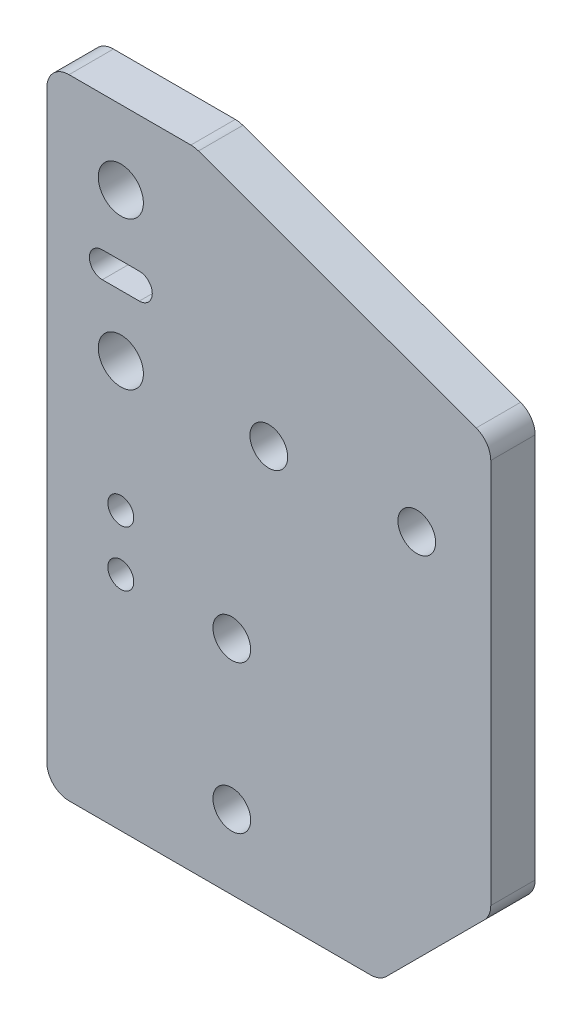
from build123d import *

# Parameters (mm, degrees)
MODEL_R                  = 3.05
MODEL_R_2                = 2.55
BODY_DEPTH               = 6
SKETCH1_R                = 1.75
FORSENSOR_DEPTH          = 10
F_5_1_5_1_FOOTINGMOUNT_D = 5.1


with BuildPart() as part:
    # Model → Body (new body)
    with BuildSketch(Plane.XY):
        with BuildLine():
            Line((59.121320344, 14.121320344), (45.878679656, 0.878679656))
            ThreePointArc((45.878679656, 0.878679656), (44.90540961, 0.228361402), (43.757359313, 0))
            Line((43.757359313, 0), (3, 0))
            ThreePointArc((3, 0), (0.878679656, 0.878679656), (0, 3))
            Line((0, 3), (0, 82))
            ThreePointArc((0, 82), (0.878679656, 84.121320344), (3, 85))
            Line((3, 85), (19.471019058, 85))
            ThreePointArc((19.471019058, 85), (19.991963591, 84.954423259), (20.497079488, 84.819077862))
            Line((20.497079488, 84.819077862), (58.02606043, 71.159645877))
            ThreePointArc((58.02606043, 71.159645877), (59.457456133, 70.061297324), (60, 68.340568015))
            Line((60, 68.340568015), (60, 16.242640687))
            ThreePointArc((60, 16.242640687), (59.771638598, 15.09459039), (59.121320344, 14.121320344))
        make_face()
        with Locations((10, 75)):
            Circle(MODEL_R, mode=Mode.SUBTRACT)
        with Locations((10, 55)):
            Circle(MODEL_R, mode=Mode.SUBTRACT)
        with Locations((30, 55)):
            Circle(MODEL_R_2, mode=Mode.SUBTRACT)
        with Locations((50, 55)):
            Circle(MODEL_R_2, mode=Mode.SUBTRACT)
        with BuildLine():
            Line((12.5, 63.25), (7.5, 63.25))
            ThreePointArc((7.5, 63.25), (5.75, 65), (7.5, 66.75))
            Line((7.5, 66.75), (12.5, 66.75))
            ThreePointArc((12.5, 66.75), (14.25, 65), (12.5, 63.25))
        make_face(mode=Mode.SUBTRACT)
    extrude(amount=BODY_DEPTH)

    # Sketch1 → ForSensor (cut)
    with BuildSketch(Plane(origin=(0, 0, 0), x_dir=(-1, 0, 0), z_dir=(0, 0, -1))):
        with Locations((-10, 30)):
            Circle(SKETCH1_R)
        with Locations((-10, 37.5)):
            Circle(SKETCH1_R)
    extrude(amount=-FORSENSOR_DEPTH, mode=Mode.SUBTRACT)

    # Ø5.1 (5.1) FootingMount (through all)
    with Locations(Plane.XY.offset(6)):
        with Locations((25, 10), (25, 30)):
            Hole(F_5_1_5_1_FOOTINGMOUNT_D / 2)


solid = part.part
